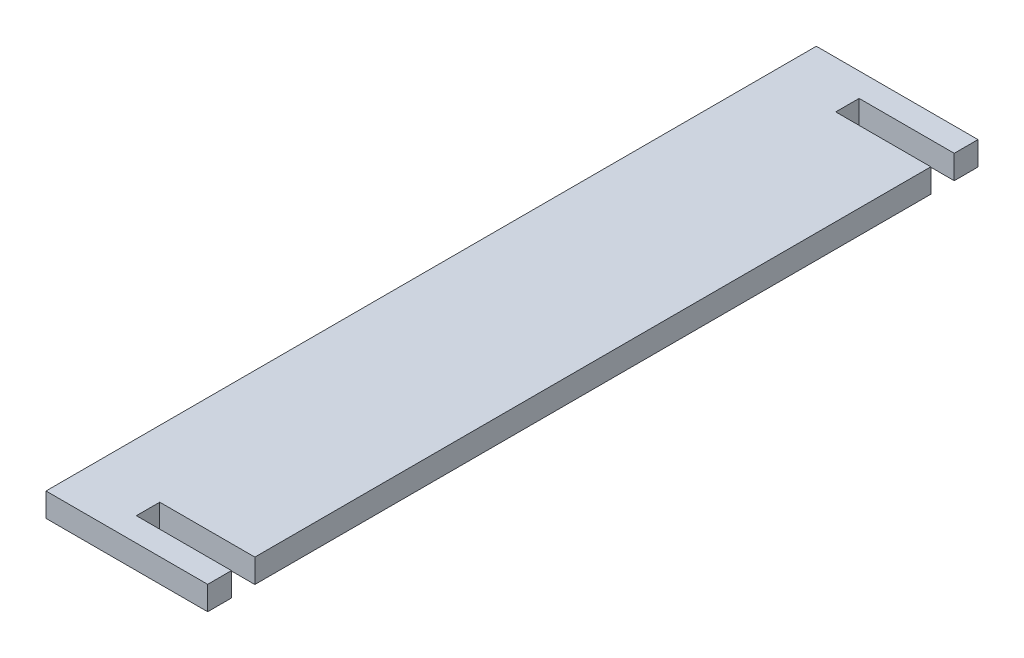
from build123d import *

# Parameters (mm, degrees)
BOSS_EXTRUDE1_DEPTH = 3.175


with BuildPart() as part:
    # Sketch1 → Boss-Extrude1 (new body)
    with BuildSketch(Plane(origin=(0, 0, 0), x_dir=(1, 0, 0), z_dir=(0, 1, 0))):
        Polygon((0, 0), (21.59, 0), (21.59, 3.175), (8.89, 3.175), (8.89, 6.2992), (21.59, 6.2992), (21.59, 96.5708), (8.89, 96.5708), (8.89, 99.695), (21.59, 99.695), (21.59, 102.87), (0, 102.87), align=None)
    extrude(amount=BOSS_EXTRUDE1_DEPTH)


solid = part.part
